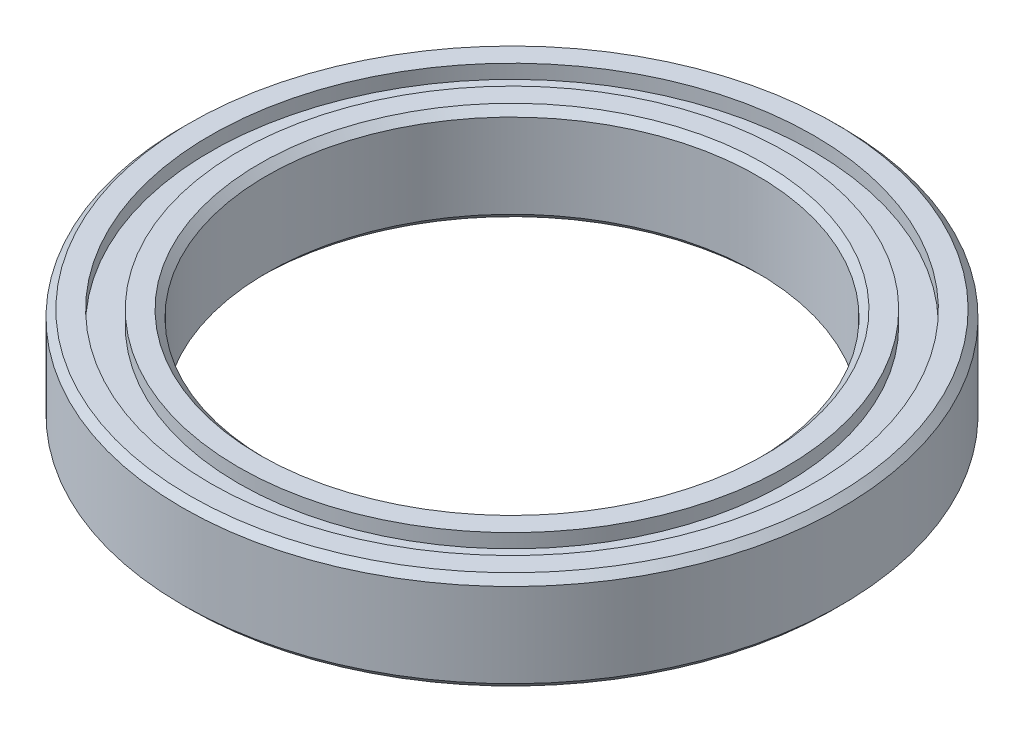
from build123d import *

# Parameters (mm, degrees)
SKETCH1_R           = 23.5
SKETCH1_R_2         = 17.5
BOSS_EXTRUDE1_DEPTH = 7
SKETCH2_R           = 21.5
SKETCH2_R_2         = 19.5
CUT_EXTRUDE1_DEPTH  = 1
CUT_EXTRUDE2_START  = -1
SKETCH3_R           = 21.5
SKETCH3_R_2         = 19.5
CUT_EXTRUDE2_DEPTH  = 1
CHAMFER1_SIZE       = 0.5


with BuildPart() as part:
    # Sketch1 → Boss-Extrude1 (new body)
    with BuildSketch(Plane(origin=(0, 0, 0), x_dir=(1, 0, 0), z_dir=(0, 1, 0))):
        with Locations(Location((0, 0, 0), (0, 0, 270))):
            Circle(SKETCH1_R)
        with Locations(Location((0, 0, 0), (0, 0, 270))):
            Circle(SKETCH1_R_2, mode=Mode.SUBTRACT)
    extrude(amount=BOSS_EXTRUDE1_DEPTH)

    # Sketch2 → Cut-Extrude1 (cut)
    with BuildSketch(Plane(origin=(0, 7, 0), x_dir=(1, 0, 0), z_dir=(0, 1, 0))):
        with Locations(Location((0, 0, 0), (0, 0, 270))):
            Circle(SKETCH2_R)
        with Locations(Location((0, 0, 0), (0, 0, 270))):
            Circle(SKETCH2_R_2, mode=Mode.SUBTRACT)
    extrude(amount=-CUT_EXTRUDE1_DEPTH, mode=Mode.SUBTRACT)

    # Sketch3 → Cut-Extrude2 (cut)
    with BuildSketch(Plane.XZ.offset(CUT_EXTRUDE2_START)):
        with Locations(Location((0, 0, 0), (0, 0, 90))):
            Circle(SKETCH3_R)
        with Locations(Location((0, 0, 0), (0, 0, 90))):
            Circle(SKETCH3_R_2, mode=Mode.SUBTRACT)
    extrude(amount=CUT_EXTRUDE2_DEPTH, mode=Mode.SUBTRACT)

    # Chamfer1
    chamfer1_edges = [part.edges().sort_by_distance(p)[0] for p in [
        (0, 0, -23.5),
        (0, 7, -23.5),
        (0, 0, -17.5),
        (0, 7, -17.5),
    ]]
    chamfer(chamfer1_edges, length=CHAMFER1_SIZE)


solid = part.part
